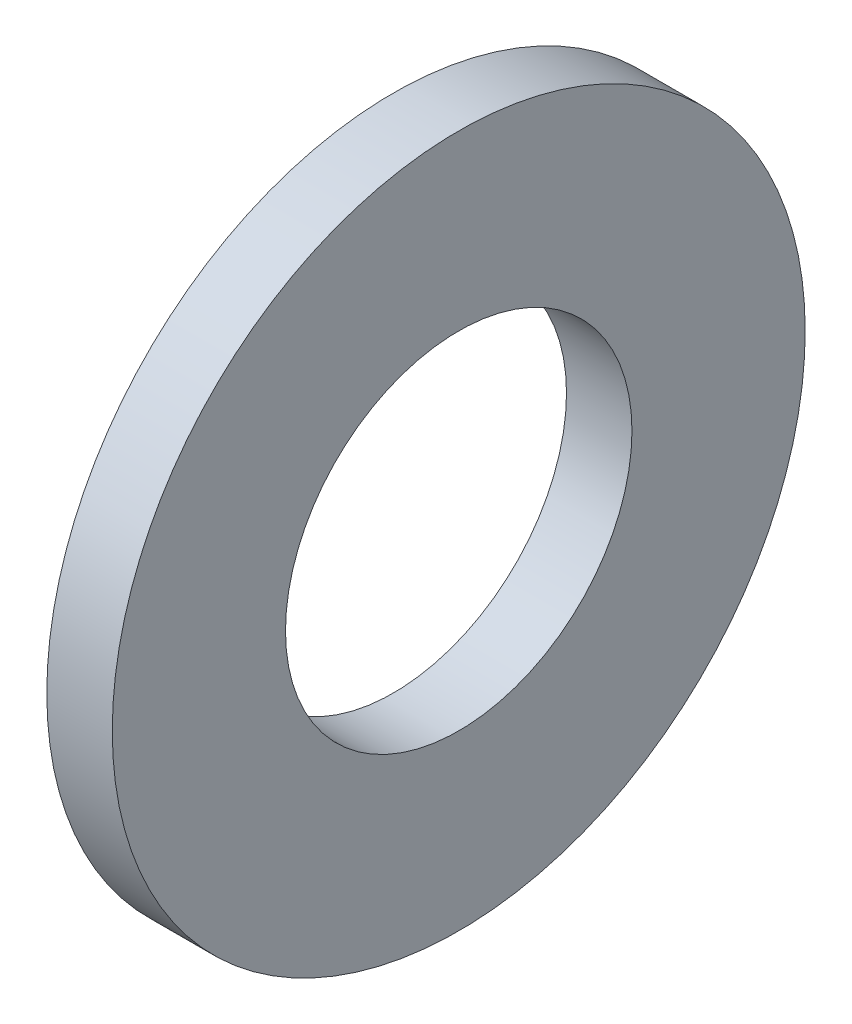
from build123d import *

# Parameters (mm, degrees)
SKETCH1_W = 1.651
SKETCH1_H = 4.3688


with BuildPart() as part:
    # Sketch1 → Base-Revolve (revolve)
    with BuildSketch(Plane.XY, mode=Mode.PRIVATE) as base_revolve_sk:
        with Locations((-0.8255, 6.5532)):
            Rectangle(SKETCH1_W, SKETCH1_H)
    revolve(base_revolve_sk.sketch.rotate(Axis((-34.925, 0, 0), (1, 0, 0)), 90), axis=Axis((-34.925, 0, 0), (1, 0, 0)))


solid = part.part
